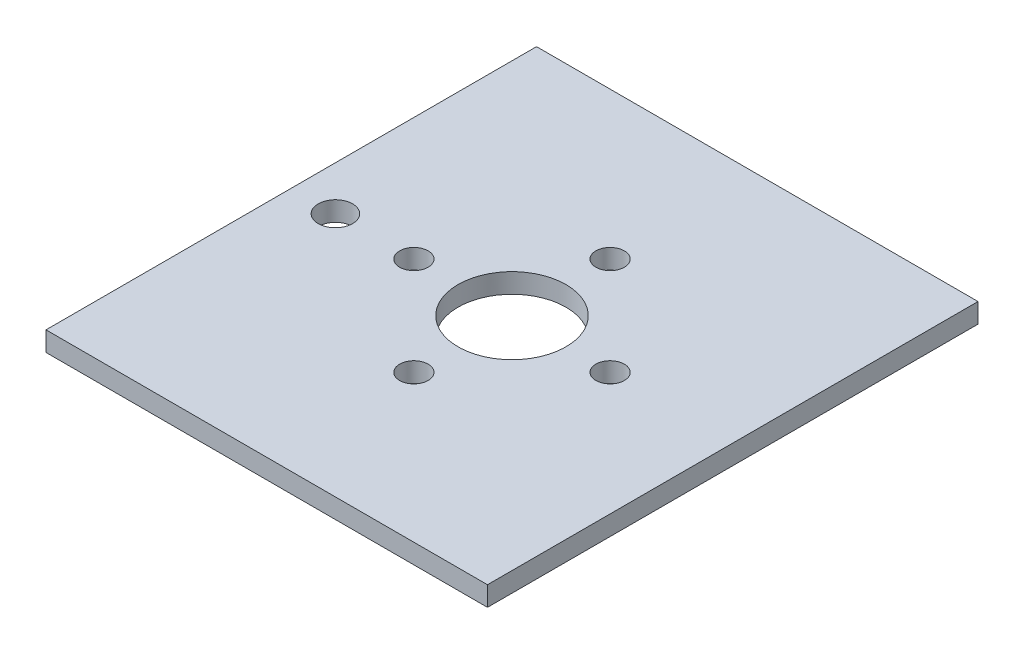
from build123d import *

# Parameters (mm, degrees)
ESQUISSE1_W                  = 90
ESQUISSE1_H                  = 100
BOSS_EXTRU_1_DEPTH           = 4
ENL_V_MAT_EXTRU_1_DEPTH      = 1401.799142477
ENL_V_MAT_EXTRU_1_DEPTH_BACK = 1401.799142477
ESQUISSE2_R                  = 11
D_GAGEMENT_M51_D             = 5.8
D_GAGEMENT_M51_DEPTH         = 20
D_GAGEMENT_M51_TIP           = 1.742495795
D_GAGEMENT_M61_D             = 7
D_GAGEMENT_M61_DEPTH         = 20
D_GAGEMENT_M61_TIP           = 2.103012167


with BuildPart() as part:
    # Esquisse1 → Boss.-Extru.1 (new body)
    with BuildSketch(Plane(origin=(0, 0, 0), x_dir=(1, 0, 0), z_dir=(0, 1, 0))):
        Rectangle(ESQUISSE1_W, ESQUISSE1_H)
    extrude(amount=BOSS_EXTRU_1_DEPTH)

    # Esquisse2 → Enlèv. mat.-Extru.1 (cut, two sides: drawn at the far end of the back side and taken through both)
    with BuildSketch(Plane(origin=(-1346.410161514, -150, 0), x_dir=(0, 0, -1), z_dir=(0, 1, 0)).offset(-ENL_V_MAT_EXTRU_1_DEPTH_BACK)):
        with Locations((0, -1346.410161514)):
            Circle(ESQUISSE2_R)
    extrude(amount=ENL_V_MAT_EXTRU_1_DEPTH + ENL_V_MAT_EXTRU_1_DEPTH_BACK, mode=Mode.SUBTRACT)

    # Dégagement M51
    with Locations(Plane(origin=(0, -8, 0), x_dir=(-1, 0, 0), z_dir=(0, -1, 0))):
        with Locations((20, 0), (0, -20), (-20, 0), (0, 20)):
            Hole(D_GAGEMENT_M51_D / 2, depth=D_GAGEMENT_M51_DEPTH)
            with Locations((0, 0, -(D_GAGEMENT_M51_DEPTH + D_GAGEMENT_M51_TIP / 2))):  # 118° drill point
                Cone(0, D_GAGEMENT_M51_D / 2, D_GAGEMENT_M51_TIP, mode=Mode.SUBTRACT)

    # Dégagement M61
    with Locations(Plane(origin=(0, 0, 0), x_dir=(-1, 0, 0), z_dir=(0, -1, 0))):
        with Locations((36, 0)):
            Hole(D_GAGEMENT_M61_D / 2, depth=D_GAGEMENT_M61_DEPTH)
            with Locations((0, 0, -(D_GAGEMENT_M61_DEPTH + D_GAGEMENT_M61_TIP / 2))):  # 118° drill point
                Cone(0, D_GAGEMENT_M61_D / 2, D_GAGEMENT_M61_TIP, mode=Mode.SUBTRACT)


solid = part.part
